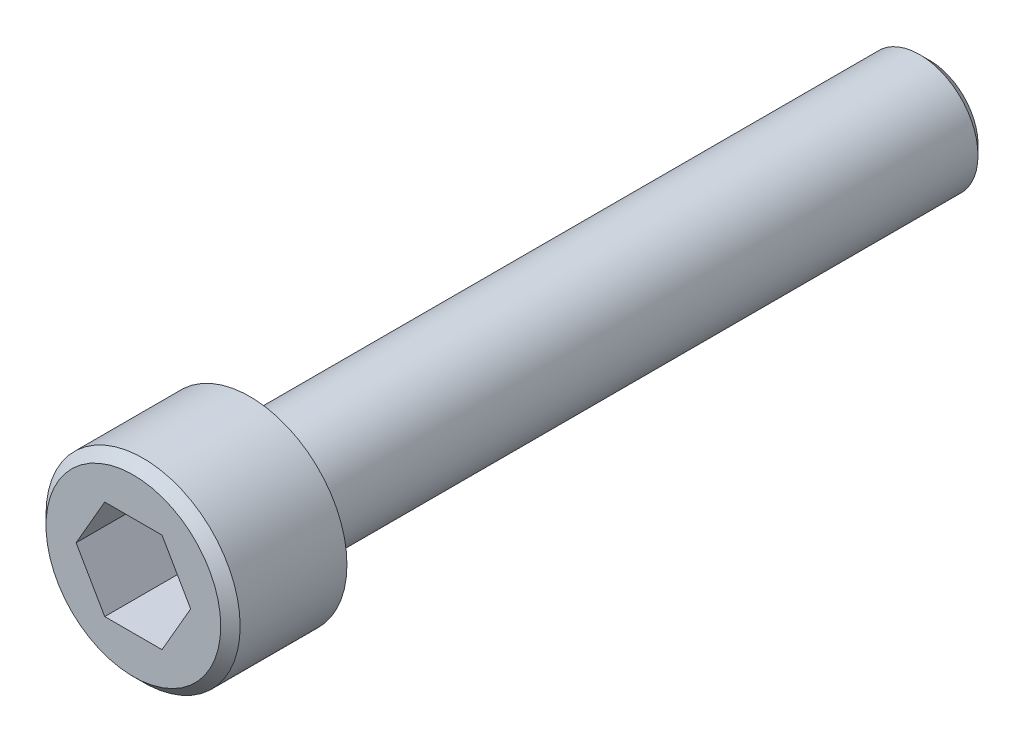
from build123d import *

# Parameters (mm, degrees)
CROQUIS1_R              = 5
SALIENTE_EXTRUIR1_DEPTH = 6
CROQUIS2_R              = 3
SALIENTE_EXTRUIR2_DEPTH = 35
CHAFL_N1_SIZE           = 0.5
CORTAR_EXTRUIR1_DEPTH   = 4


with BuildPart() as part:
    # Croquis1 → Saliente-Extruir1 (new body)
    with BuildSketch(Plane.XY):
        Circle(CROQUIS1_R)
    extrude(amount=SALIENTE_EXTRUIR1_DEPTH)

    # Croquis2 → Saliente-Extruir2 (add)
    with BuildSketch(Plane(origin=(0, 0, 0), x_dir=(-1, 0, 0), z_dir=(0, 0, -1))):
        with Locations(Location((0, 0, 0), (0, 0, 180))):
            Circle(CROQUIS2_R)
    extrude(amount=SALIENTE_EXTRUIR2_DEPTH)

    # Chaflán1
    chafl_n1_edges = [part.edges().sort_by_distance(p)[0] for p in [
        (-5, 0, 6),
        (-3, 0, -35),
    ]]
    chamfer(chafl_n1_edges, length=CHAFL_N1_SIZE)

    # Croquis3 → Cortar-Extruir1 (cut)
    with BuildSketch(Plane.XY.offset(6)):
        Polygon((2.95, 0), (1.475, 2.554774941), (-1.475, 2.554774941), (-2.95, 0), (-1.475, -2.554774941), (1.475, -2.554774941), align=None)
    extrude(amount=-CORTAR_EXTRUIR1_DEPTH, mode=Mode.SUBTRACT)


solid = part.part
